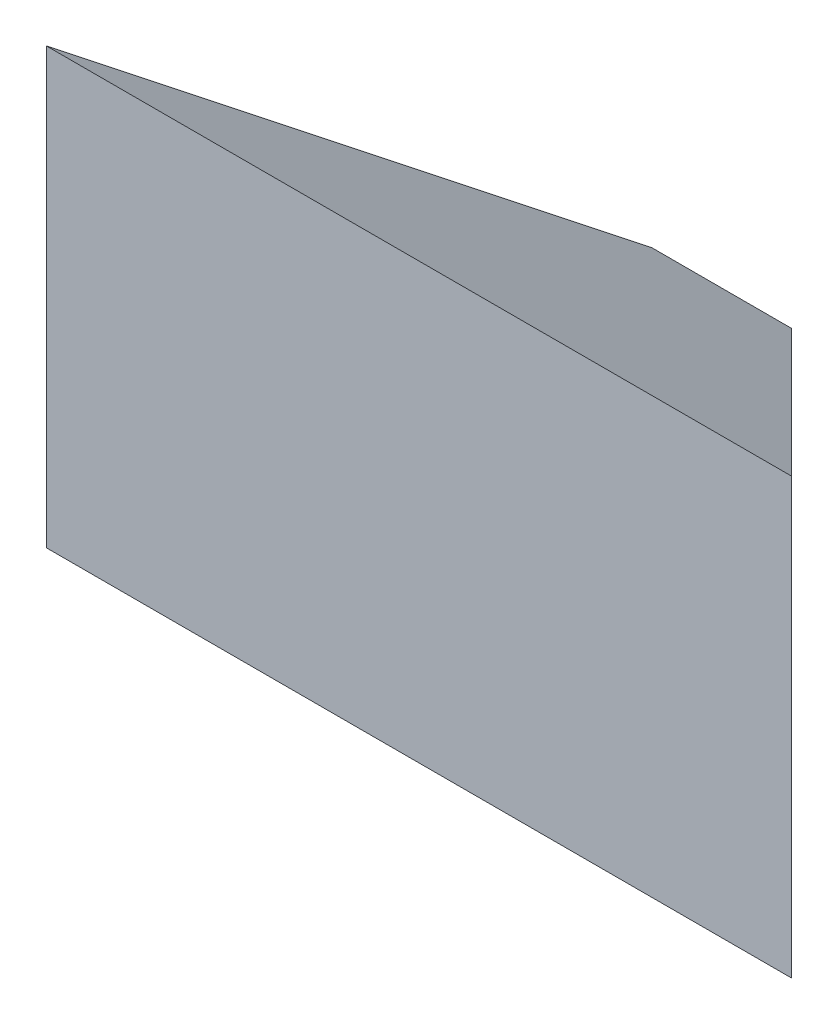
from build123d import *


with BuildPart() as part:
    # Sketch1 → Loft1 section 0
    with BuildSketch(Plane.XY):
        with BuildLine():
            Line((-11.5, 1), (11.5, 1))
            Line((11.5, 1), (11.5, 15.035205868))
            Line((11.5, 15.035205868), (-11.5, 15.035205868))
            Line((-11.5, 15.035205868), (-11.5, 1))
        make_face()
    # Sketch2 → Loft1 section 1
    with BuildSketch(Plane.XY.offset(50)):
        with BuildLine():
            Line((-61.5, -27.868360277), (61.5, -27.868360277))
            Line((61.5, -27.868360277), (61.5, 43.903566145))
            Line((61.5, 43.903566145), (-61.5, 43.903566145))
            Line((-61.5, 43.903566145), (-61.5, -27.868360277))
        make_face()
    loft()


solid = part.part
